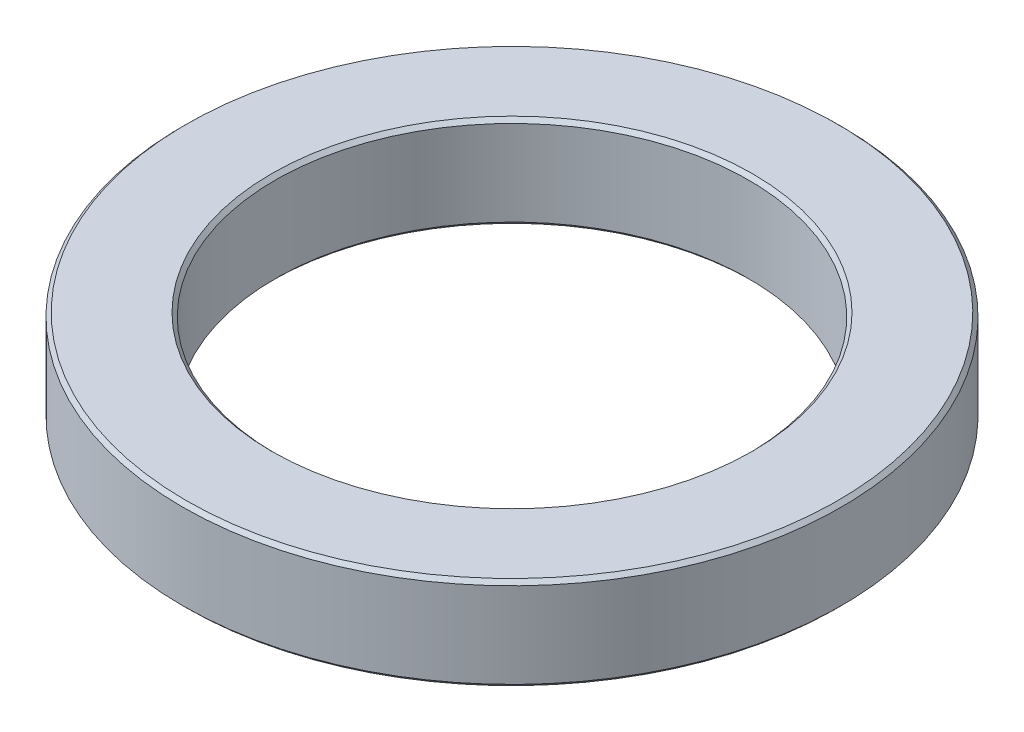
from build123d import *

# Parameters (mm, degrees)
SKETCH1_R           = 17.75
SKETCH1_R_2         = 12.75
BOSS_EXTRUDE1_DEPTH = 5
CHAMFER1_SIZE       = 0.2


with BuildPart() as part:
    # Sketch1 → Boss-Extrude1 (new body)
    with BuildSketch(Plane(origin=(0, 0, 0), x_dir=(1, 0, 0), z_dir=(0, 1, 0))):
        with Locations(Location((0, 0, 0), (0, 0, 270))):
            Circle(SKETCH1_R)
        with Locations(Location((0, 0, 0), (0, 0, 270))):
            Circle(SKETCH1_R_2, mode=Mode.SUBTRACT)
    extrude(amount=BOSS_EXTRUDE1_DEPTH)

    # Chamfer1
    chamfer1_edges = [part.edges().sort_by_distance(p)[0] for p in [
        (0, 0, -17.75),
        (0, 5, -17.75),
        (0, 0, -12.75),
        (0, 5, -12.75),
    ]]
    chamfer(chamfer1_edges, length=CHAMFER1_SIZE)


solid = part.part
